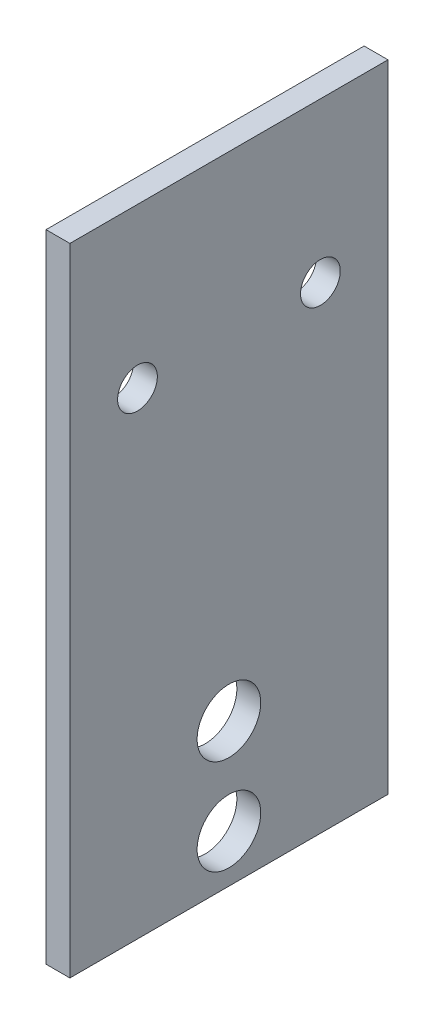
from build123d import *

# Parameters (mm, degrees)
SKETCH1_W           = 40
SKETCH1_H           = 80
BOSS_EXTRUDE1_DEPTH = 3
SKETCH2_R           = 4
SKETCH2_R_2         = 2.5
CUT_EXTRUDE1_DEPTH  = 45.821869662


with BuildPart() as part:
    # Sketch1 → Boss-Extrude1 (new body)
    with BuildSketch(Plane(origin=(0, 0, 0), x_dir=(0, 0, -1), z_dir=(1, 0, 0))):
        Rectangle(SKETCH1_W, SKETCH1_H)
    extrude(amount=BOSS_EXTRUDE1_DEPTH)

    # Sketch2 → Cut-Extrude1 (cut, through all)
    with BuildSketch(Plane(origin=(3, 0, 0), x_dir=(0, 0, -1), z_dir=(1, 0, 0))):
        with Locations((0, -22)):
            Circle(SKETCH2_R)
        with Locations((0, -34)):
            Circle(SKETCH2_R)
        with Locations((-11.5, 20)):
            Circle(SKETCH2_R_2)
        with Locations((11.5, 20)):
            Circle(SKETCH2_R_2)
    extrude(amount=-CUT_EXTRUDE1_DEPTH, mode=Mode.SUBTRACT)


solid = part.part
